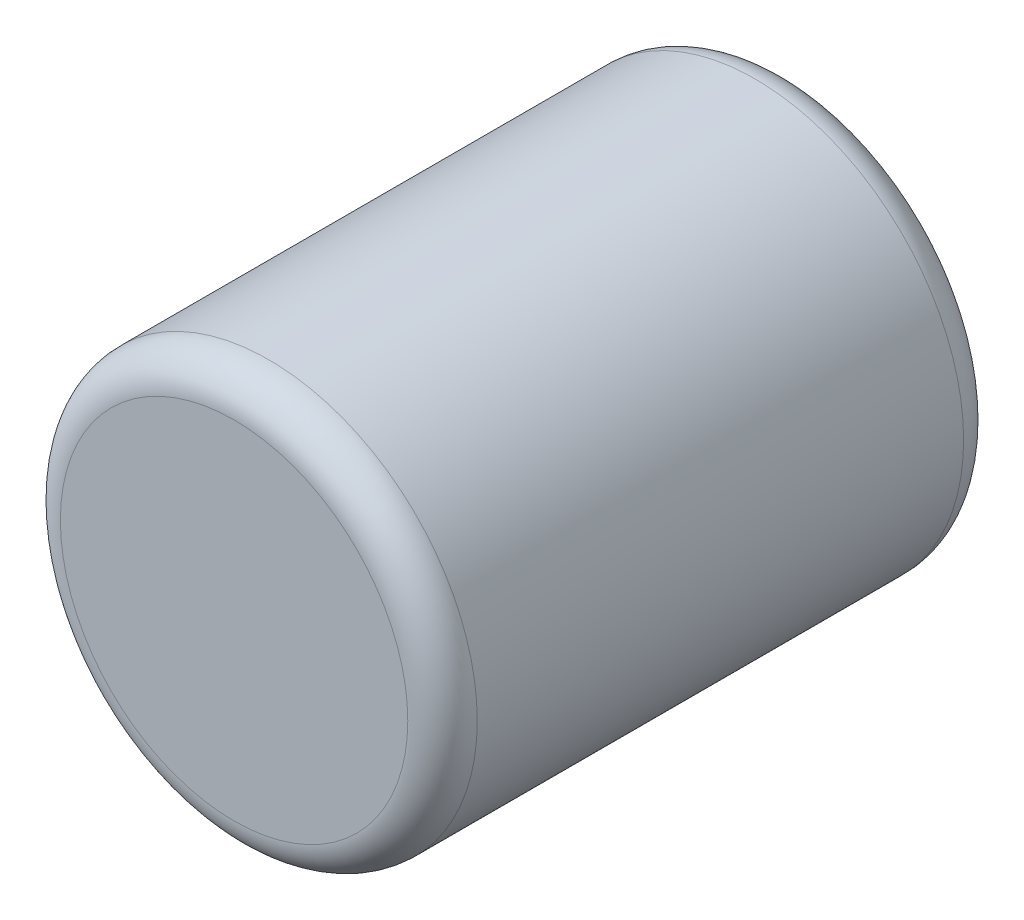
from build123d import *


with BuildPart() as part:
    # 草圖1 → 旋轉1 (revolve)
    with BuildSketch(Plane(origin=(0, 0, 0), x_dir=(1, 0, 0), z_dir=(0, 1, 0))):
        with BuildLine():
            Line((2.5, 0), (0, 0))
            Line((0, 0), (0, -8))
            Line((0, -8), (2.5, -8))
            ThreePointArc((2.5, -8), (2.853553391, -7.853553391), (3, -7.5))
            Line((3, -7.5), (3, -0.5))
            ThreePointArc((3, -0.5), (2.853553391, -0.146446609), (2.5, 0))
        make_face()
    revolve(axis=Axis((0, 0, -0.002738152), (0, 0, 1)))


solid = part.part
